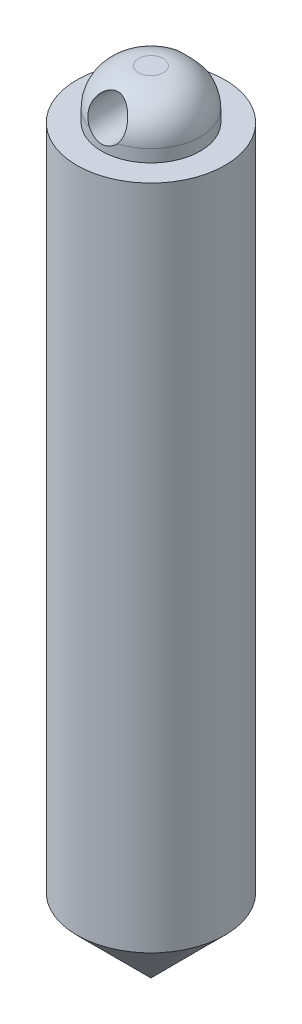
from build123d import *

# Parameters (mm, degrees)
SKETCH1_R               = 30
BOSS_EXTRUDE1_DEPTH     = 270
CUT_EXTRUDE1_START      = -2
SKETCH2_R               = 29
CUT_EXTRUDE1_DEPTH      = 270
SKETCH5_W               = 10
SKETCH5_H               = 15
SKETCH8_R               = 20
BOSS_EXTRUDE2_DEPTH     = 20
FILLET1_R               = 15
CUT_EXTRUDE2_DEPTH      = 294.087017795
CUT_EXTRUDE2_DEPTH_BACK = 294.087017795
SKETCH10_R              = 7.5


with BuildPart() as part:
    # Sketch1 → Boss-Extrude1 (new body)
    with BuildSketch(Plane(origin=(0, 0, 0), x_dir=(1, 0, 0), z_dir=(0, 1, 0))):
        with Locations(Location((0, 0, 0), (0, 0, 270))):
            Circle(SKETCH1_R)
    extrude(amount=BOSS_EXTRUDE1_DEPTH)

    # Sketch2 → Cut-Extrude1 (cut)
    with BuildSketch(Plane(origin=(0, 270, 0), x_dir=(1, 0, 0), z_dir=(0, 1, 0)).offset(CUT_EXTRUDE1_START)):
        with Locations(Location((0, 0, 0), (0, 0, 270))):
            Circle(SKETCH2_R)
    extrude(amount=-CUT_EXTRUDE1_DEPTH, mode=Mode.SUBTRACT)

    # Sketch3 → Revolve1 (revolve)
    with BuildSketch(Plane(origin=(0, 0, 0), x_dir=(0, 0, -1), z_dir=(1, 0, 0)), mode=Mode.PRIVATE) as revolve1_sk:
        Polygon((0, 0), (0, -30), (30, 0), align=None)
    revolve(revolve1_sk.sketch.rotate(Axis((0, 0, 0), (0, -1, 0)), 180), axis=Axis((0, 0, 0), (0, -1, 0)))

    # Sketch8 → Boss-Extrude2 (add)
    with BuildSketch(Plane(origin=(0, 270, 0), x_dir=(1, 0, 0), z_dir=(0, 1, 0))):
        with Locations(Location((0, 0, 0), (0, 0, 270))):
            Circle(SKETCH8_R)
    extrude(amount=BOSS_EXTRUDE2_DEPTH)

    # Fillet1
    fillet1_edges = [part.edges().sort_by_distance(p)[0] for p in [
        (0, 290, -20),
    ]]
    fillet(fillet1_edges, radius=FILLET1_R)

    # Sketch10 → Cut-Extrude2 (cut, two sides: drawn at the far end of the back side and taken through both)
    with BuildSketch(Plane.XY.offset(-CUT_EXTRUDE2_DEPTH_BACK)):
        with Locations(Location((0, 280, 0), (0, 0, 318.189685104))):
            Circle(SKETCH10_R)
    extrude(amount=CUT_EXTRUDE2_DEPTH + CUT_EXTRUDE2_DEPTH_BACK, mode=Mode.SUBTRACT)


with BuildPart() as body_2:
    # Sketch5 → Revolve2 (revolve)
    with BuildSketch(Plane.XY, mode=Mode.PRIVATE) as revolve2_sk:
        with Locations((-23.642796434, 42.5)):
            Rectangle(SKETCH5_W, SKETCH5_H)
    revolve(revolve2_sk.sketch.rotate(Axis((0, 35, 0), (0, 1, 0)), 270), axis=Axis((0, 35, 0), (0, 1, 0)))


solid = Compound([part.part, body_2.part])
